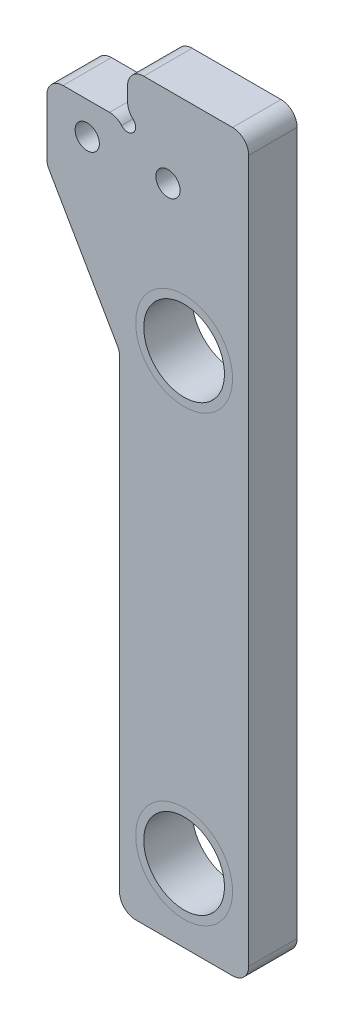
from build123d import *

# Parameters (mm, degrees)
SKETCH_1_R          = 6
SKETCH_1_R_2        = 1.5
EXTRUDE_1_DEPTH     = 6
SKETCH_2_R          = 6
SKETCH_2_R_2        = 5
EXTRUDE_2_DEPTH     = 6
EXTRUDE_2_2_DEPTH   = 6
SKETCH_3_R          = 8
SKETCH_3_R_2        = 5
EXTRUDE_3_DEPTH     = 0.5
EXTRUDE_3_2_DEPTH   = 0.5
SKETCH_4_R          = 8
SKETCH_4_R_2        = 5
EXTRUDE_4_DEPTH     = 0.5
EXTRUDE_4_2_DEPTH   = 0.5
SKETCH_5_W          = 15
SKETCH_5_H          = 6
EXTRUDE_5_DEPTH     = 6
SKETCH_6_R          = 1
CUT_EXTRUDE_1_DEPTH = 6
CUT_EXTRUDE_4_DEPTH = 6
FILLET_5_R          = 2


with BuildPart() as part:
    # 草图1 → 凸台-拉伸1 (new body)
    with BuildSketch(Plane.XY):
        Polygon((8, 20.95), (8, -64.05), (-12, -64.05), (-17, -35.693590902), (-17, 20.95), align=None)
        Circle(SKETCH_1_R, mode=Mode.SUBTRACT)
        with Locations((0, -55)):
            Circle(SKETCH_1_R, mode=Mode.SUBTRACT)
        with Locations((-2, 16.95)):
            Circle(SKETCH_1_R_2, mode=Mode.SUBTRACT)
        with Locations((-12, 16.95)):
            Circle(SKETCH_1_R_2, mode=Mode.SUBTRACT)
    extrude(amount=EXTRUDE_1_DEPTH)

    # 草图5 → 凸台-拉伸5 (add)
    with BuildSketch(Plane(origin=(0, 0, 0), x_dir=(-1, 0, 0), z_dir=(0, 0, -1))):
        with Locations((-0.5, 23.95)):
            Rectangle(SKETCH_5_W, SKETCH_5_H)
    extrude(amount=-EXTRUDE_5_DEPTH)

    # 草图6 → 切除-拉伸1 (cut)
    with BuildSketch(Plane(origin=(0, 0, 0), x_dir=(-1, 0, 0), z_dir=(0, 0, -1))):
        with Locations((7, 20.95)):
            Circle(SKETCH_6_R)
    extrude(amount=-CUT_EXTRUDE_1_DEPTH, mode=Mode.SUBTRACT)

    # 草图9 → 切除-拉伸4 (cut)
    with BuildSketch(Plane.XY.offset(6)):
        Polygon((-12, -64.05), (-8, -64.05), (-8, -4.05), (-17, 11.538457268), (-17, -35.693590902), align=None)
    extrude(amount=-CUT_EXTRUDE_4_DEPTH, mode=Mode.SUBTRACT)

    # 圆角5
    fillet_5_edges = [part.edges().sort_by_distance(p)[0] for p in [
        (8, 26.95, 3),
        (-7, 26.95, 3),
        (-7, 21.95, 3),
        (-8, 20.95, 3),
        (-8, -4.05, 3),
        (-8, -64.05, 3),
        (-17, 11.538457268, 3),
        (8, -64.05, 3),
        (-17, 20.95, 3),
    ]]
    fillet(fillet_5_edges, radius=FILLET_5_R)


with BuildPart() as body_2:
    # 草图2 → 凸台-拉伸2 (new body)
    with BuildSketch(Plane.XY.offset(6)):
        with Locations((0, -55)):
            Circle(SKETCH_2_R)
        with Locations((0, -55)):
            Circle(SKETCH_2_R_2, mode=Mode.SUBTRACT)
    extrude(amount=-EXTRUDE_2_DEPTH)


with BuildPart() as body_3:
    # 草图2 → Extrude 2 2 (new body)
    with BuildSketch(Plane.XY.offset(6)):
        Circle(SKETCH_2_R)
        Circle(SKETCH_2_R_2, mode=Mode.SUBTRACT)
    extrude(amount=-EXTRUDE_2_2_DEPTH)


with BuildPart() as body_4:
    # 草图3 → 凸台-拉伸3 (new body)
    with BuildSketch(Plane.XY.offset(6)):
        Circle(SKETCH_3_R)
        Circle(SKETCH_3_R_2, mode=Mode.SUBTRACT)
    extrude(amount=EXTRUDE_3_DEPTH)


with BuildPart() as body_5:
    # 草图3 → Extrude 3 2 (new body)
    with BuildSketch(Plane.XY.offset(6)):
        with Locations((0, -55)):
            Circle(SKETCH_3_R)
        with Locations((0, -55)):
            Circle(SKETCH_3_R_2, mode=Mode.SUBTRACT)
    extrude(amount=EXTRUDE_3_2_DEPTH)


with BuildPart() as body_6:
    # 草图4 → 凸台-拉伸4 (new body)
    with BuildSketch(Plane(origin=(0, 0, 0), x_dir=(-1, 0, 0), z_dir=(0, 0, -1))):
        with Locations(Location((0, -55, 0), (0, 0, 180))):
            Circle(SKETCH_4_R)
        with Locations(Location((0, -55, 0), (0, 0, 180))):
            Circle(SKETCH_4_R_2, mode=Mode.SUBTRACT)
    extrude(amount=EXTRUDE_4_DEPTH)


with BuildPart() as body_7:
    # 草图4 → Extrude 4 2 (new body)
    with BuildSketch(Plane(origin=(0, 0, 0), x_dir=(-1, 0, 0), z_dir=(0, 0, -1))):
        with Locations(Location((0, 0, 0), (0, 0, 180))):
            Circle(SKETCH_4_R)
        with Locations(Location((0, 0, 0), (0, 0, 180))):
            Circle(SKETCH_4_R_2, mode=Mode.SUBTRACT)
    extrude(amount=EXTRUDE_4_2_DEPTH)


solid = Compound([part.part, body_2.part, body_3.part])
